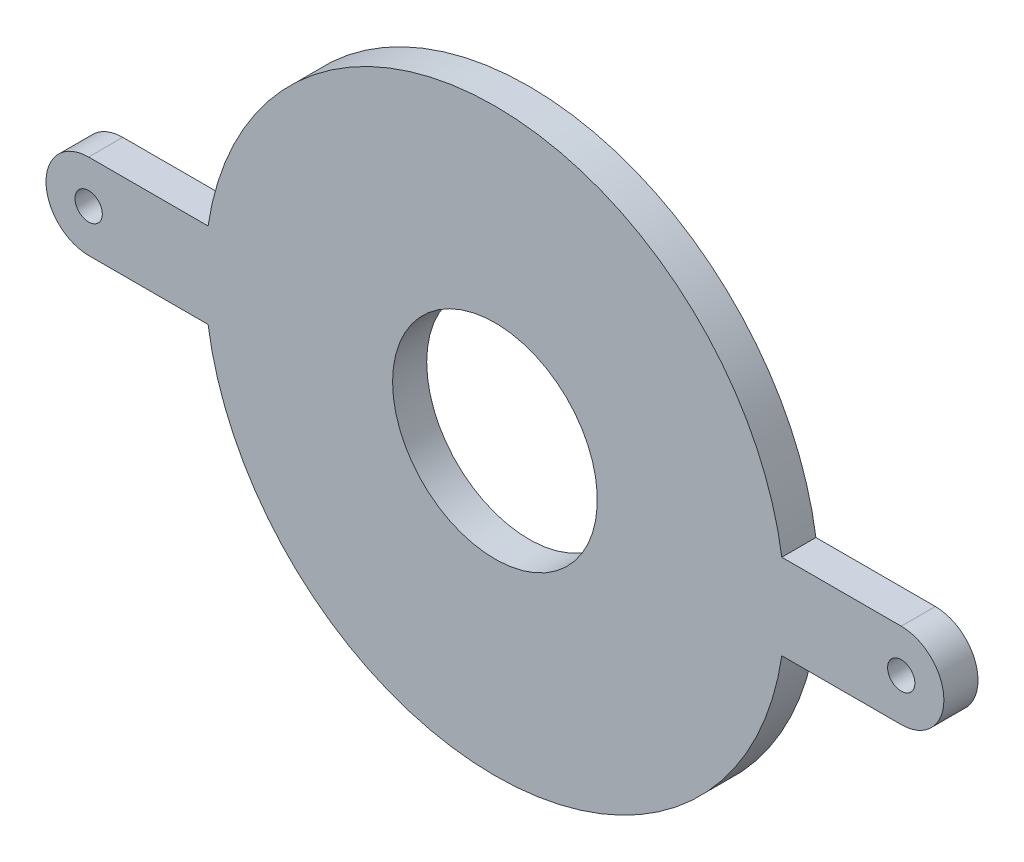
from build123d import *

# Parameters (mm, degrees)
SKETCH_1_R               = 19
EXTRUDE_1_DEPTH          = 20
EXTRUDE_2_DEPTH          = 3
SKETCH_6_R               = 17
CUT_EXTRUDE_1_DEPTH      = 18
SKETCH_7_R               = 17
SKETCH_7_R_2             = 15
EXTRUDE_3_DEPTH          = 9.5
CUT_EXTRUDE_2_REACH      = 44.629
SKETCH_8_R               = 13
EXTRUDE_START            = -2
EXTRUDE_4_DEPTH          = 2
HOLE_WIZARD_M3_1_D       = 2.5
HOLE_WIZARD_M3_1_DEPTH   = 3
HOLE_WIZARD_M2_1_D       = 1.6
CUT_EXTRUDE_3_DEPTH      = 44.800684926
CUT_EXTRUDE_3_DEPTH_BACK = 44.800684926
SKETCH_17_W              = 74
SKETCH_17_H              = 33
SKETCH_18_R              = 15
SKETCH_18_R_2            = 6
EXTRUDE_5_DEPTH          = 2


with BuildPart() as part:
    # 草图1 → 凸台-拉伸1 (new body)
    with BuildSketch(Plane.XY):
        Circle(SKETCH_1_R)
    extrude(amount=EXTRUDE_1_DEPTH)

    # 草图3 → 凸台-拉伸2 (add)
    with BuildSketch(Plane.XY.offset(20)):
        with BuildLine():
            Line((-22.5, 10), (22.5, 10))
            ThreePointArc((22.5, 10), (32.5, 0), (22.5, -10))
            Line((22.5, -10), (-22.5, -10))
            ThreePointArc((-22.5, -10), (-32.5, 0), (-22.5, 10))
        make_face()
    extrude(amount=-EXTRUDE_2_DEPTH)

    # 草图6 → 切除-拉伸1 (cut)
    with BuildSketch(Plane.XY.offset(20)):
        Circle(SKETCH_6_R)
    extrude(amount=-CUT_EXTRUDE_1_DEPTH, mode=Mode.SUBTRACT)

    # 草图7 → 凸台-拉伸3 (add)
    with BuildSketch(Plane(origin=(0, 0, 0), x_dir=(-1, 0, 0), z_dir=(0, 0, -1))):
        with Locations(Location((0, 0, 0), (0, 0, 180))):
            Circle(SKETCH_7_R)
        Circle(SKETCH_7_R_2, mode=Mode.SUBTRACT)
    extrude(amount=EXTRUDE_3_DEPTH)

    # 草图8 → 切除-拉伸2 (cut, up to next)
    with BuildSketch(Plane(origin=(0, 0, 0), x_dir=(-1, 0, 0), z_dir=(0, 0, -1)), mode=Mode.PRIVATE) as cut_extrude_2_sk1:
        Circle(SKETCH_8_R)
    cut_extrude_2_tool1 = extrude(cut_extrude_2_sk1.sketch, amount=-CUT_EXTRUDE_2_REACH, mode=Mode.PRIVATE) & part.part
    add(cut_extrude_2_tool1.solids().sort_by_distance((0, 0, 0))[0], mode=Mode.SUBTRACT)

    # 草图10 → 凸台-拉伸4 (add)
    with BuildSketch(Plane(origin=(0, 0, -9.5), x_dir=(-1, 0, 0), z_dir=(0, 0, -1)).offset(EXTRUDE_START)):
        with BuildLine():
            Line((-16.815171721, 2.5), (-23.815171721, 2.5))
            ThreePointArc((-23.815171721, 2.5), (-26.315171721, 0), (-23.815171721, -2.5))
            Line((-23.815171721, -2.5), (-16.815171721, -2.5))
            ThreePointArc((-16.815171721, -2.5), (-17, 0), (-16.815171721, 2.5))
        make_face()
        with BuildLine():
            Line((16.815171721, 2.5), (23.815171721, 2.5))
            ThreePointArc((23.815171721, 2.5), (26.315171721, 0), (23.815171721, -2.5))
            Line((23.815171721, -2.5), (16.815171721, -2.5))
            ThreePointArc((16.815171721, -2.5), (17, 0), (16.815171721, 2.5))
        make_face()
    extrude(amount=EXTRUDE_4_DEPTH)

    # M3 螺纹孔的螺纹孔钻头1
    with Locations(Plane(origin=(0, 0, 17), x_dir=(-1, 0, 0), z_dir=(0, 0, -1))):
        with Locations((-23.815171721, 0)):
            hole_wizard_m3_1 = Hole(HOLE_WIZARD_M3_1_D / 2, depth=HOLE_WIZARD_M3_1_DEPTH)

    # M2 螺纹孔的螺纹孔钻头1 (through all)
    with Locations(Plane(origin=(0, 0, -9.5), x_dir=(-1, 0, 0), z_dir=(0, 0, -1))):
        with Locations((-23.815171721, 0)):
            hole_wizard_m2_1 = Hole(HOLE_WIZARD_M2_1_D / 2)

    # 镜向1: M3 螺纹孔的螺纹孔钻头1, M2 螺纹孔的螺纹孔钻头1 across plane
    add(hole_wizard_m3_1.mirror(Plane(origin=(0, 0, 0), x_dir=(0, 0, 1), z_dir=(1, 0, 0))), mode=Mode.SUBTRACT)
    add(hole_wizard_m2_1.mirror(Plane(origin=(0, 0, 0), x_dir=(0, 0, 1), z_dir=(1, 0, 0))), mode=Mode.SUBTRACT)

    # 草图17 → 切除-拉伸3 (cut, two sides: drawn at the far end of the back side and taken through both)
    with BuildSketch(Plane.XZ.offset(2.5).offset(-CUT_EXTRUDE_3_DEPTH_BACK)):
        with Locations((0, 9)):
            Rectangle(SKETCH_17_W, SKETCH_17_H)
    extrude(amount=CUT_EXTRUDE_3_DEPTH + CUT_EXTRUDE_3_DEPTH_BACK, mode=Mode.SUBTRACT)

    # 草图18 → 凸台-拉伸5 (add)
    with BuildSketch(Plane(origin=(0, 0, -9.5), x_dir=(-1, 0, 0), z_dir=(0, 0, -1)).offset(EXTRUDE_START)):
        Circle(SKETCH_18_R)
        Circle(SKETCH_18_R_2, mode=Mode.SUBTRACT)
    extrude(amount=EXTRUDE_5_DEPTH)


solid = part.part
